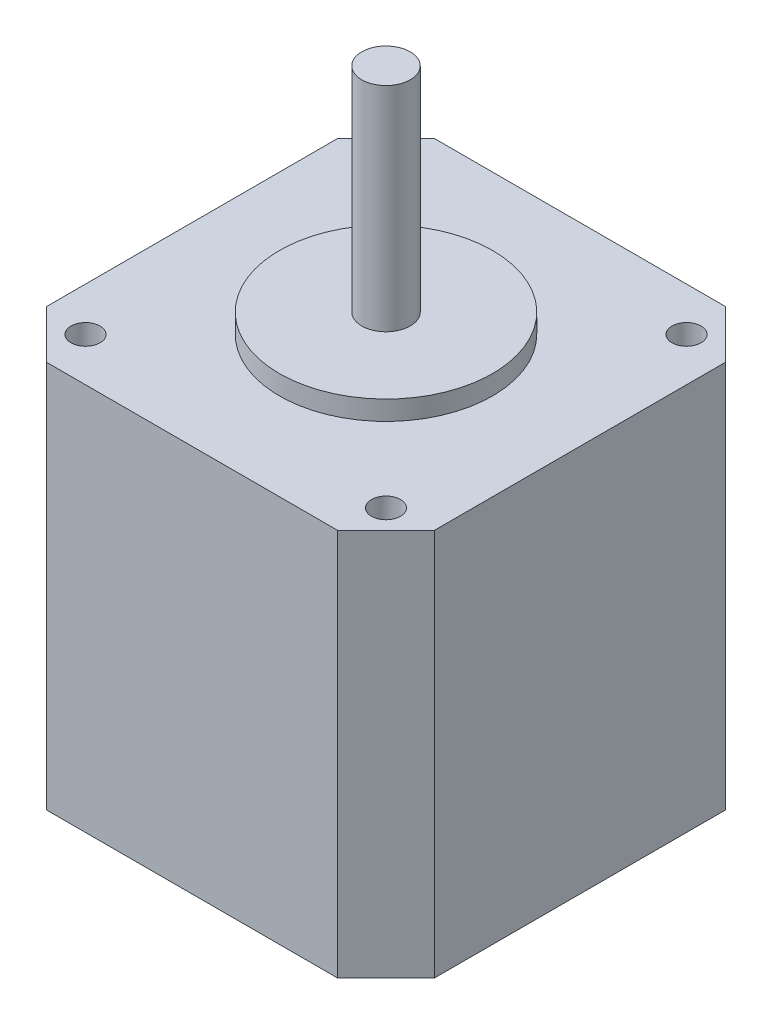
from build123d import *

# Parameters (mm, degrees)
BOSS_EXTRUDE1_DEPTH  = 40
SKETCH2_R            = 11
BOSS_EXTRUDE2_DEPTH  = 2
SKETCH3_R            = 2.5
BOSS_EXTRUDE3_DEPTH  = 22
SKETCH4_R            = 1.5
CUT_EXTRUDE1_DEPTH   = 86.416626016
LPATTERN1_COUNT      = 2
LPATTERN1_PITCH      = 31
LPATTERN1_COUNT_DIR2 = 2
LPATTERN1_PITCH_DIR2 = 31


with BuildPart() as part:
    # Sketch1 → Boss-Extrude1 (new body)
    with BuildSketch(Plane(origin=(0, 0, 0), x_dir=(1, 0, 0), z_dir=(0, 1, 0))):
        Polygon((0, 35), (5, 40), (35, 40), (40, 35), (40, 5), (35, 0), (5, 0), (0, 5), align=None)
    extrude(amount=BOSS_EXTRUDE1_DEPTH)

    # Sketch2 → Boss-Extrude2 (add)
    with BuildSketch(Plane(origin=(0, 40, 0), x_dir=(1, 0, 0), z_dir=(0, 1, 0))):
        with Locations(Location((20, 20, 0), (0, 0, 90))):
            Circle(SKETCH2_R)
    extrude(amount=BOSS_EXTRUDE2_DEPTH)

    # Sketch3 → Boss-Extrude3 (add)
    with BuildSketch(Plane(origin=(0, 42, 0), x_dir=(1, 0, 0), z_dir=(0, 1, 0))):
        with Locations(Location((20, 20, 0), (0, 0, 270))):
            Circle(SKETCH3_R)
    extrude(amount=BOSS_EXTRUDE3_DEPTH)

    # Sketch4 → Cut-Extrude1 (cut, through all)
    with BuildSketch(Plane.XZ):
        with Locations(Location((4.5, -4.5, 0), (0, 0, 270))):
            Circle(SKETCH4_R)
    cut_extrude1 = extrude(amount=-CUT_EXTRUDE1_DEPTH, mode=Mode.SUBTRACT)

    # LPattern1: Cut-Extrude1 2 × 2
    with Locations(*[(i * LPATTERN1_PITCH, 0, -j * LPATTERN1_PITCH_DIR2) for i in range(LPATTERN1_COUNT) for j in range(LPATTERN1_COUNT_DIR2) if (i, j) != (0, 0)]):
        add(cut_extrude1, mode=Mode.SUBTRACT)


solid = part.part
